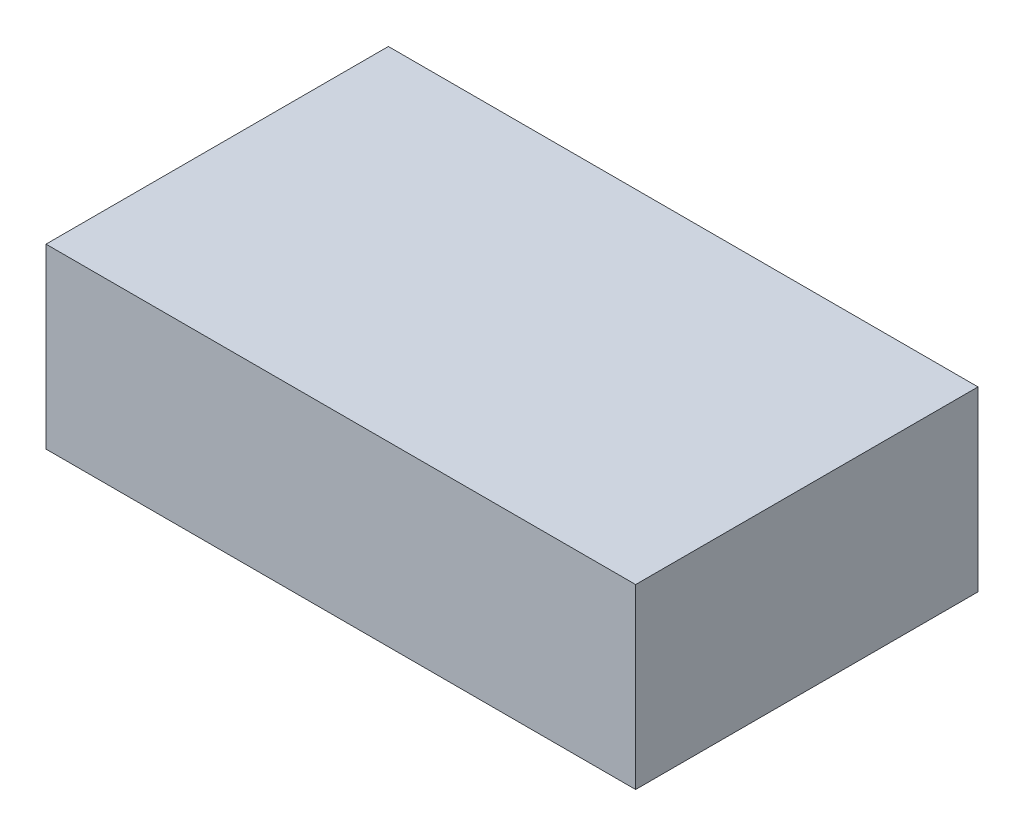
from build123d import *

# Parameters (mm, degrees)
SKETCH1_W           = 46.5
SKETCH1_H           = 27
BOSS_EXTRUDE1_DEPTH = 14


with BuildPart() as part:
    # Sketch1 → Boss-Extrude1 (new body)
    with BuildSketch(Plane(origin=(0, 0, 0), x_dir=(1, 0, 0), z_dir=(0, 1, 0))):
        with Locations((23.25, 13.5)):
            Rectangle(SKETCH1_W, SKETCH1_H)
    extrude(amount=BOSS_EXTRUDE1_DEPTH)


solid = part.part
